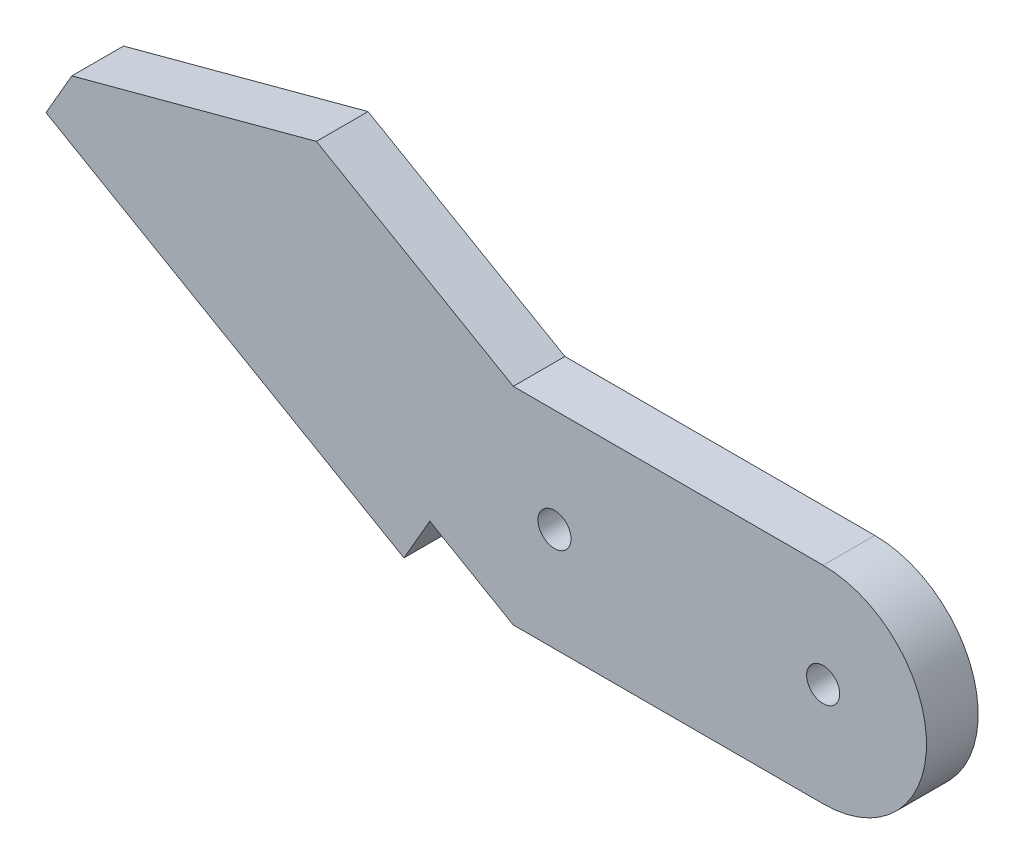
from build123d import *

# Parameters (mm, degrees)
SKETCH2_R           = 1.6
BOSS_EXTRUDE1_DEPTH = 5


with BuildPart() as part:
    # Sketch2 → Boss-Extrude1 (new body)
    with BuildSketch(Plane(origin=(0, 0, 0), x_dir=(0, 1, 0), z_dir=(0, 0, 1))):
        with BuildLine():
            Line((-10, 0), (-10, 30))
            Line((-10, 30), (-5.341066605, 38.069509349))
            Line((-5.341066605, 38.069509349), (-9.671193624, 40.569509349))
            Line((-9.671193624, 40.569509349), (10.328806376, 75.210525501))
            Line((10.328806376, 75.210525501), (14.658933395, 72.710525501))
            Line((14.658933395, 72.710525501), (21, 49.045342756))
            Line((21, 49.045342756), (10, 29.992783873))
            Line((10, 29.992783873), (10, 0))
            ThreePointArc((10, 0), (0, -10), (-10, 0))
        make_face()
        with Locations(Location((0, 0, 0), (0, 0, 270))):
            Circle(SKETCH2_R, mode=Mode.SUBTRACT)
        with Locations(Location((0, 26, 0), (0, 0, 270))):
            Circle(SKETCH2_R, mode=Mode.SUBTRACT)
    extrude(amount=BOSS_EXTRUDE1_DEPTH)


solid = part.part
